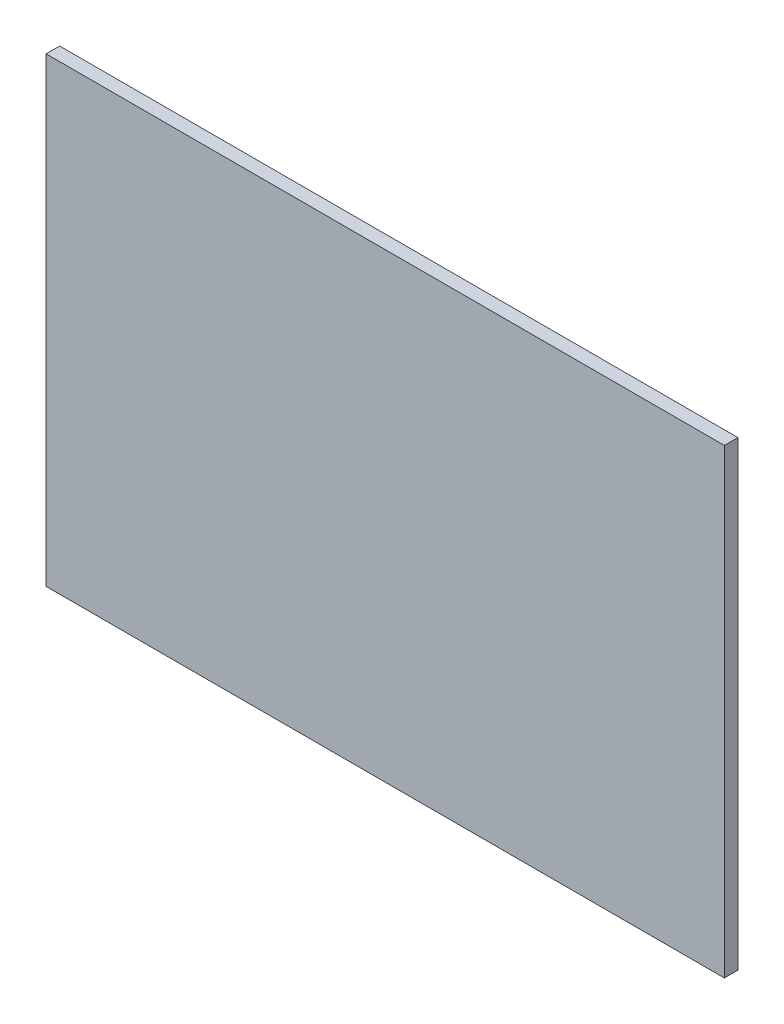
from build123d import *

# Parameters (mm, degrees)
CROQUIS1_W              = 100
CROQUIS1_H              = 68
SALIENTE_EXTRUIR1_DEPTH = 2


with BuildPart() as part:
    # Croquis1 → Saliente-Extruir1 (new body)
    with BuildSketch(Plane.XY):
        Rectangle(CROQUIS1_W, CROQUIS1_H)
    extrude(amount=SALIENTE_EXTRUIR1_DEPTH)


solid = part.part
